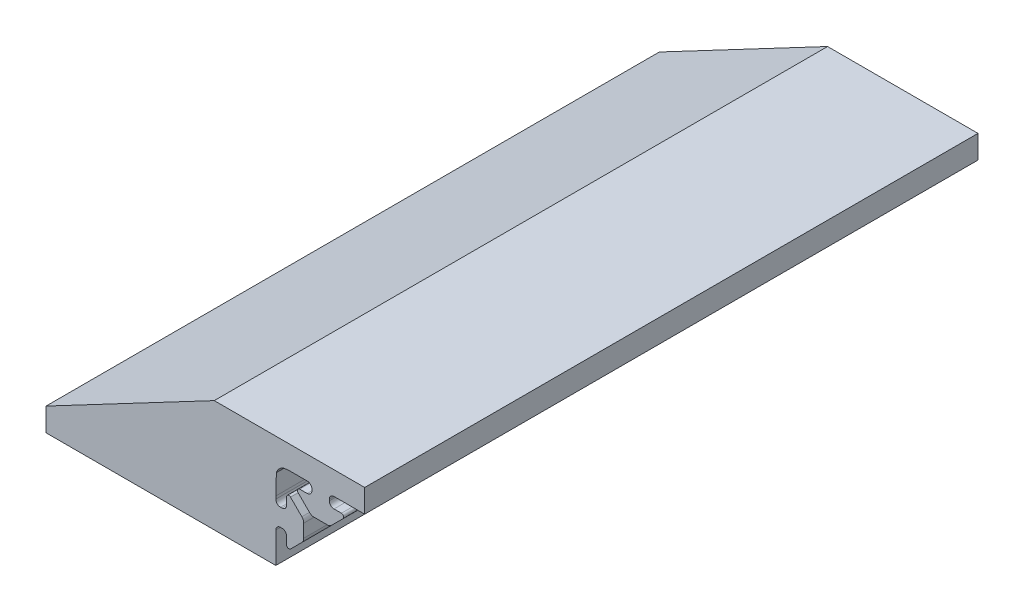
from build123d import *

# Parameters (mm, degrees)
BOSS_EXTRUDE1_DEPTH = 265
SKETCH3_R           = 1.65
CUT_EXTRUDE1_DEPTH  = 40


with BuildPart() as part:
    # Sketch2 → Boss-Extrude1 (new body)
    with BuildSketch(Plane.XY):
        with BuildLine():
            ThreePointArc((-3.764, 17.3228), (-4.357753133, 18.756246867), (-5.7912, 19.35))
            Line((-5.7912, 19.35), (-6.964305235, 19.35))
            Line((-6.964305235, 19.35), (-8.996305235, 19.35))
            Line((-8.996305235, 19.35), (-13.723477062, 19.35))
            Line((-13.723477062, 19.35), (-15.821601592, 19.115365338))
            ThreePointArc((-15.821601592, 19.115365338), (-17.870947824, 17.870947824), (-19.115365338, 15.821601592))
            Line((-19.115365338, 15.821601592), (-19.35, 6.964305235))
            Line((-19.35, 6.964305235), (-19.35, 5.7912))
            ThreePointArc((-19.35, 5.7912), (-18.756246867, 4.357753133), (-17.3228, 3.764))
            Line((-17.3228, 3.764), (-16.7132, 3.764))
            ThreePointArc((-16.7132, 3.764), (-15.279753133, 4.357753133), (-14.686, 5.7912))
            Line((-14.686, 5.7912), (-14.686, 8.996305235))
            ThreePointArc((-14.686, 8.996305235), (-14.074427708, 9.911587851), (-12.994778249, 9.696832221))
            Line((-12.994778249, 9.696832221), (-8.101029797, 4.803083769))
            ThreePointArc((-8.101029797, 4.803083769), (-7.497079234, 3.899207877), (-7.285, 2.833013566))
            Line((-7.285, 2.833013566), (-7.285, -2.833013566))
            ThreePointArc((-7.285, -2.833013566), (-7.497079234, -3.899207877), (-8.101029797, -4.803083769))
            Line((-8.101029797, -4.803083769), (-12.994778249, -9.696832221))
            ThreePointArc((-12.994778249, -9.696832221), (-14.074427708, -9.911587851), (-14.686, -8.996305235))
            Line((-14.686, -8.996305235), (-14.686, -5.7912))
            ThreePointArc((-14.686, -5.7912), (-15.279753133, -4.357753133), (-16.7132, -3.764))
            Line((-16.7132, -3.764), (-17.3228, -3.764))
            ThreePointArc((-17.3228, -3.764), (-18.756246867, -4.357753133), (-19.35, -5.7912))
            Line((-19.35, -5.7912), (-19.35, -6.964305235))
            Line((-19.35, -6.964305235), (-19.35, -19.05))
            Line((-19.35, -19.05), (-118.649495781, -19.05))
            Line((-118.649495781, -19.05), (-118.649495781, -9.05))
            Line((-118.649495781, -9.05), (-45.95, 29.35))
            Line((-45.95, 29.35), (19.05, 29.35))
            Line((19.05, 29.35), (19.05, 19.35))
            Line((19.05, 19.35), (6.964305235, 19.35))
            Line((6.964305235, 19.35), (5.7912, 19.35))
            ThreePointArc((5.7912, 19.35), (4.357753133, 18.756246867), (3.764, 17.3228))
            Line((3.764, 17.3228), (3.764, 16.7132))
            ThreePointArc((3.764, 16.7132), (4.357753133, 15.279753133), (5.7912, 14.686))
            Line((5.7912, 14.686), (8.996305235, 14.686))
            ThreePointArc((8.996305235, 14.686), (9.911587851, 14.074427708), (9.696832221, 12.994778249))
            Line((9.696832221, 12.994778249), (4.803083769, 8.101029797))
            ThreePointArc((4.803083769, 8.101029797), (3.899207877, 7.497079234), (2.833013566, 7.285))
            Line((2.833013566, 7.285), (-2.833013566, 7.285))
            ThreePointArc((-2.833013566, 7.285), (-3.899207877, 7.497079234), (-4.803083769, 8.101029797))
            Line((-4.803083769, 8.101029797), (-9.696832221, 12.994778249))
            ThreePointArc((-9.696832221, 12.994778249), (-9.911587851, 14.074427708), (-8.996305235, 14.686))
            Line((-8.996305235, 14.686), (-5.7912, 14.686))
            ThreePointArc((-5.7912, 14.686), (-4.357753133, 15.279753133), (-3.764, 16.7132))
            Line((-3.764, 16.7132), (-3.764, 17.3228))
        make_face()
    extrude(amount=-BOSS_EXTRUDE1_DEPTH)

    # Sketch3 → Cut-Extrude1 (cut)
    with BuildSketch(Plane.ZY.offset(118.649495781)):
        with Locations((-10, -14.05)):
            Circle(SKETCH3_R)
        with Locations((-275.03, -14.05)):
            Circle(SKETCH3_R)
        with Locations((-142.515, -14.05)):
            Circle(SKETCH3_R)
    extrude(amount=-CUT_EXTRUDE1_DEPTH, mode=Mode.SUBTRACT)


solid = part.part
